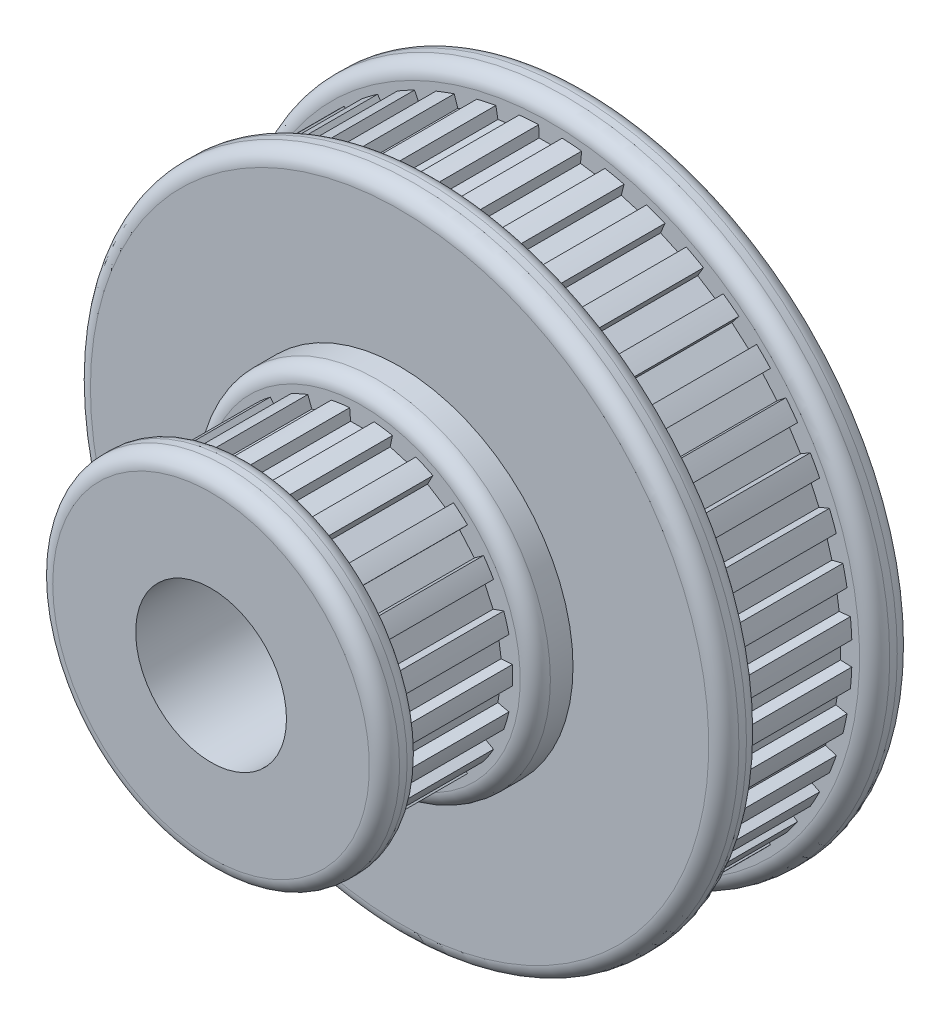
from build123d import *

# Parameters (mm, degrees)
CUT_EXTRUDE1_START = 15
CUT_EXTRUDE1_DEPTH = 15
CIRPATTERN1_COUNT  = 22
CUT_EXTRUDE2_START = 15
CUT_EXTRUDE2_DEPTH = 15
CIRPATTERN2_COUNT  = 44
FILLET1_R          = 2


with BuildPart() as part:
    # Sketch1 → Revolve1 (revolve)
    with BuildSketch(Plane(origin=(0, 0, 0), x_dir=(0, 0, -1), z_dir=(1, 0, 0)), mode=Mode.PRIVATE) as revolve1_sk:
        Polygon((0, 10), (50, 10), (50, 43), (45, 43), (45, 40), (30, 40), (30, 43), (25, 43), (25, 23), (20, 23), (20, 20), (5, 20), (5, 23), (0, 23), align=None)
    revolve(revolve1_sk.sketch.rotate(Axis((0, 0, 0), (0, 0, -1)), 90), axis=Axis((0, 0, 0), (0, 0, -1)))

    # Sketch2 → Cut-Extrude1 (cut)
    with BuildSketch(Plane.XY.offset(-20).offset(CUT_EXTRUDE1_START)):
        with BuildLine():
            Line((-1.5, 18.439088915), (1.5, 18.439088915))
            Line((1.5, 18.439088915), (1.621621622, 19.934150178))
            ThreePointArc((1.621621622, 19.934150178), (0, 20), (-1.621621622, 19.934150178))
            Line((-1.621621622, 19.934150178), (-1.5, 18.439088915))
        make_face()
    cut_extrude1 = extrude(amount=-CUT_EXTRUDE1_DEPTH, mode=Mode.SUBTRACT)

    # CirPattern1: Cut-Extrude1 ×22 about axis
    cirpattern1_axis = Axis((0, 0, 0), (0, 0, 1))
    for i in range(1, CIRPATTERN1_COUNT):
        add(cut_extrude1.rotate(cirpattern1_axis, i * 360 / CIRPATTERN1_COUNT), mode=Mode.SUBTRACT)

    # Sketch3 → Cut-Extrude2 (cut)
    with BuildSketch(Plane.XY.offset(-45).offset(CUT_EXTRUDE2_START)):
        with BuildLine():
            Line((-1.5, 38.470768123), (1.5, 38.470768123))
            Line((1.5, 38.470768123), (1.558441558, 39.969629219))
            ThreePointArc((1.558441558, 39.969629219), (0, 40), (-1.558441558, 39.969629219))
            Line((-1.558441558, 39.969629219), (-1.5, 38.470768123))
        make_face()
    cut_extrude2 = extrude(amount=-CUT_EXTRUDE2_DEPTH, mode=Mode.SUBTRACT)

    # CirPattern2: Cut-Extrude2 ×44 about axis
    cirpattern2_axis = Axis((0, 0, 0), (0, 0, 1))
    for i in range(1, CIRPATTERN2_COUNT):
        add(cut_extrude2.rotate(cirpattern2_axis, i * 360 / CIRPATTERN2_COUNT), mode=Mode.SUBTRACT)

    # Sketch4 → Cut-Revolve1 (revolve, cut)
    with BuildSketch(Plane(origin=(0, 0, 0), x_dir=(0, 0, -1), z_dir=(1, 0, 0)), mode=Mode.PRIVATE) as cut_revolve1_sk:
        Polygon((50, 35.5), (40, 29.726497308), (40, 26.773502692), (50, 21), align=None)
    revolve(cut_revolve1_sk.sketch.rotate(Axis((0, 0, 0), (0, 0, -1)), 90), axis=Axis((0, 0, 0), (0, 0, -1)), mode=Mode.SUBTRACT)

    # Fillet1
    fillet1_edges = [part.edges().sort_by_distance(p)[0] for p in [
        (-23, 0, 0),
        (-23, 0, -5),
        (-23, 0, -20),
        (-43, 0, -25),
        (-43, 0, -30),
        (-43, 0, -45),
        (-43, 0, -50),
        (-21, 0, -50),
        (-35.5, 0, -50),
        (-29.726497308, 0, -40),
        (-26.773502692, 0, -40),
    ]]
    fillet(fillet1_edges, radius=FILLET1_R)


solid = part.part
